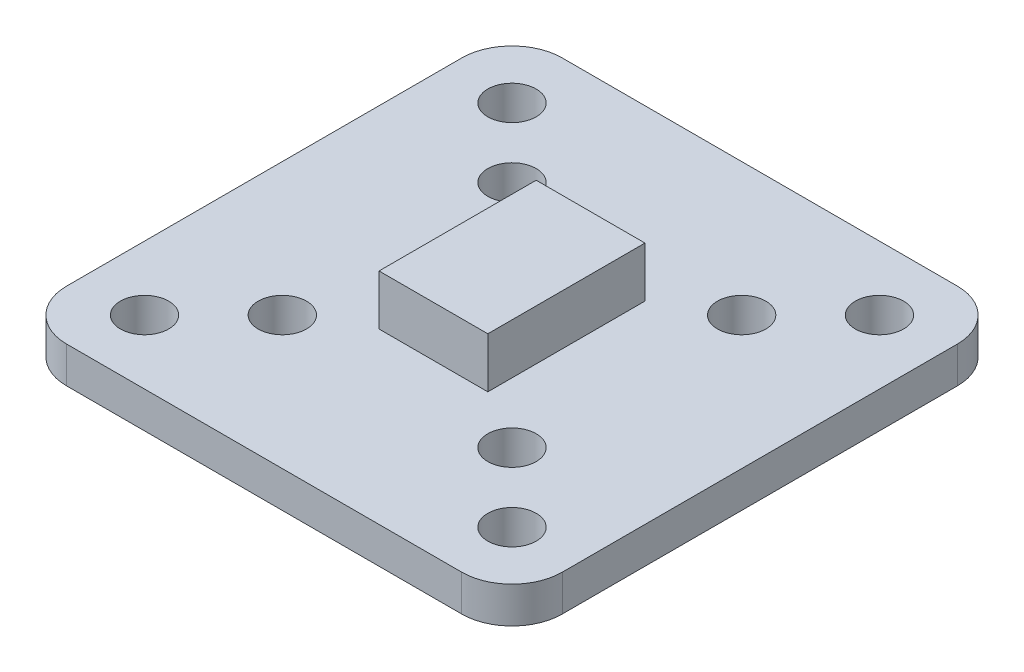
from build123d import *

# Parameters (mm, degrees)
BOSS_EXTRUDE1_DEPTH = 2.38125
SKETCH1_4_W         = 7.14375
SKETCH1_4_H         = 10.31875
BOSS_EXTRUDE2_DEPTH = 3.302
SKETCH1_5_R         = 1.5875
CUT_EXTRUDE1_DEPTH  = 24.247602802


with BuildPart() as part:
    # Sketch1 → Boss-Extrude1 (new body)
    with BuildSketch(Plane(origin=(0, 0, 0), x_dir=(1, 0, 0), z_dir=(0, 1, 0))):
        with BuildLine():
            Line((12.969875, -16.271875), (-12.969875, -16.271875))
            ThreePointArc((-12.969875, -16.271875), (-15.304741591, -15.304741591), (-16.271875, -12.969875))
            Line((-16.271875, -12.969875), (-16.271875, 12.969875))
            ThreePointArc((-16.271875, 12.969875), (-15.304741591, 15.304741591), (-12.969875, 16.271875))
            Line((-12.969875, 16.271875), (12.969875, 16.271875))
            ThreePointArc((12.969875, 16.271875), (15.304741591, 15.304741591), (16.271875, 12.969875))
            Line((16.271875, 12.969875), (16.271875, -12.969875))
            ThreePointArc((16.271875, -12.969875), (15.304741591, -15.304741591), (12.969875, -16.271875))
        make_face()
    extrude(amount=-BOSS_EXTRUDE1_DEPTH)

    # Sketch1<4> → Boss-Extrude2 (add)
    with BuildSketch(Plane(origin=(0, 0, 0), x_dir=(1, 0, 0), z_dir=(0, 1, 0))):
        Rectangle(SKETCH1_4_W, SKETCH1_4_H)
    extrude(amount=BOSS_EXTRUDE2_DEPTH)

    # Sketch1<5> → Cut-Extrude1 (cut, through all)
    with BuildSketch(Plane(origin=(0, 0, 0), x_dir=(1, 0, 0), z_dir=(0, 1, 0))):
        with Locations((12.065, 12.065)):
            Circle(SKETCH1_5_R)
        with Locations((7.540625, 7.540625)):
            Circle(SKETCH1_5_R)
        with Locations((-7.540625, -7.540625)):
            Circle(SKETCH1_5_R)
        with Locations((-12.065, -12.065)):
            Circle(SKETCH1_5_R)
        with Locations((-12.065, 12.065)):
            Circle(SKETCH1_5_R)
        with Locations((-7.540625, 7.540625)):
            Circle(SKETCH1_5_R)
        with Locations((7.540625, -7.540625)):
            Circle(SKETCH1_5_R)
        with Locations((12.065, -12.065)):
            Circle(SKETCH1_5_R)
    extrude(amount=-CUT_EXTRUDE1_DEPTH, mode=Mode.SUBTRACT)


solid = part.part
